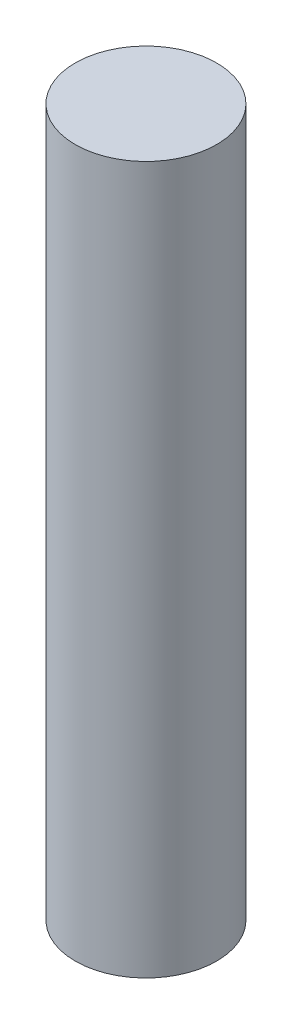
from build123d import *

# Parameters (mm, degrees)
SKETCH1_R           = 1.5875
BOSS_EXTRUDE1_DEPTH = 15.875


with BuildPart() as part:
    # Sketch1 → Boss-Extrude1 (new body)
    with BuildSketch(Plane(origin=(0, 0, 0), x_dir=(1, 0, 0), z_dir=(0, 1, 0))):
        with Locations(Location((0, 0, 0), (0, 0, 270))):
            Circle(SKETCH1_R)
    extrude(amount=BOSS_EXTRUDE1_DEPTH)


solid = part.part
